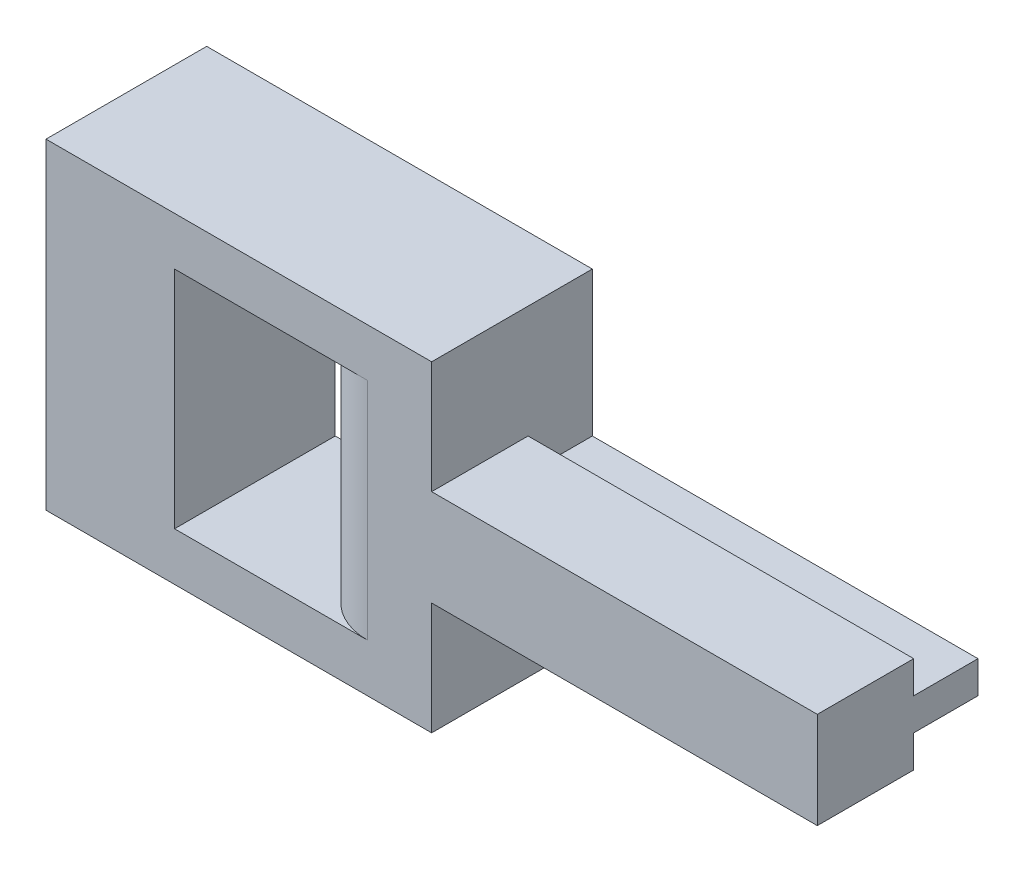
from build123d import *

# Parameters (mm, degrees)
ESBO_O1_W                = 4
ESBO_O1_H                = 7
RESSALTO_EXTRUS_O1_DEPTH = 5
FILETE1_R                = 2
ESBO_O4_W                = 2
ESBO_O4_H                = 1
CORTE_EXTRUS_O2_DEPTH    = 12


with BuildPart() as part:
    # Esboço1 → Ressalto-extrusão1 (new body)
    with BuildSketch(Plane.XY):
        Polygon((24, 3.5), (24, 6.5), (12, 6.5), (12, 10), (0, 10), (0, 0), (12, 0), (12, 3.5), align=None)
        with Locations((6, 5)):
            Rectangle(ESBO_O1_W, ESBO_O1_H, mode=Mode.SUBTRACT)
    extrude(amount=RESSALTO_EXTRUS_O1_DEPTH)

    # Filete1
    filete1_edges = [part.edges().sort_by_distance(p)[0] for p in [
        (8, 5, 5),
    ]]
    fillet(filete1_edges, radius=FILETE1_R)

    # Esboço4 → Corte-extrusão2 (cut)
    with BuildSketch(Plane(origin=(24, 0, 0), x_dir=(0, 0, -1), z_dir=(1, 0, 0))):
        with Locations((-1, 4)):
            Rectangle(ESBO_O4_W, ESBO_O4_H)
        with Locations((-1, 6)):
            Rectangle(ESBO_O4_W, ESBO_O4_H)
    extrude(amount=-CORTE_EXTRUS_O2_DEPTH, mode=Mode.SUBTRACT)


solid = part.part
